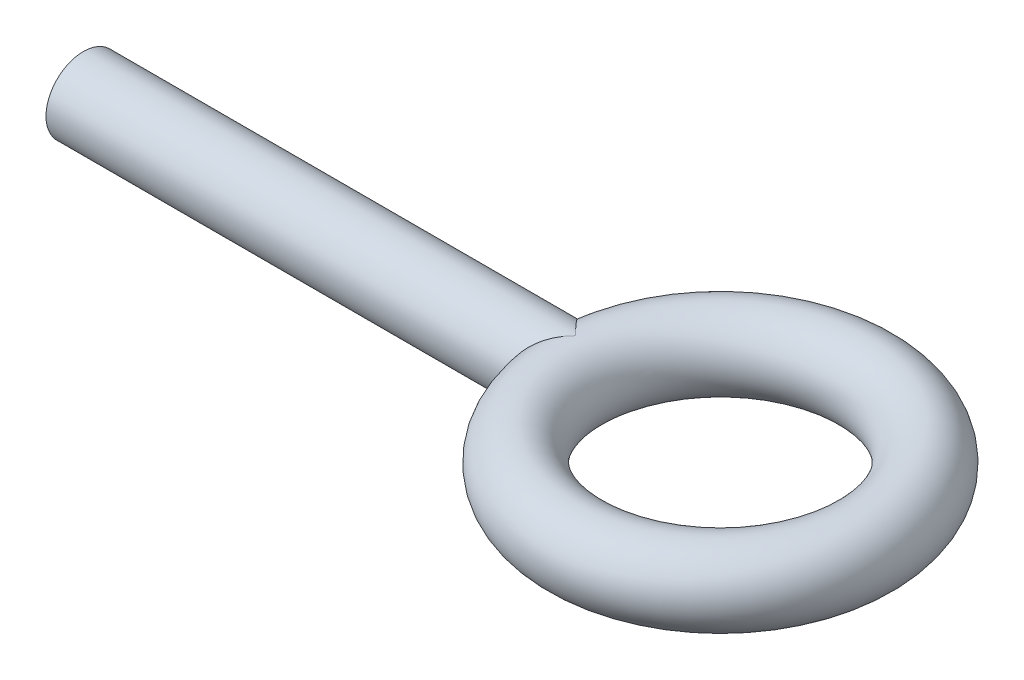
from build123d import *

# Parameters (mm, degrees)
SKETCH2_R                       = 3.6195
BOSS_EXTRUDE1_REACH             = 139.057
SKETCH3_R                       = 3.6195
BOSS_EXTRUDE1_DIRECTION_2_DEPTH = 17.272


with BuildPart() as part:
    # Sketch2 → Revolve1 (revolve)
    with BuildSketch(Plane(origin=(44.45, 0, 0), x_dir=(0, 1, 0), z_dir=(-1, 0, 0)), mode=Mode.PRIVATE) as revolve1_sk:
        with Locations((101.6, -30.4165)):
            Circle(SKETCH2_R)
    revolve(revolve1_sk.sketch.rotate(Axis((44.45, 114.3, 44.45), (0, -1, 0)), 180), axis=Axis((44.45, 114.3, 44.45), (0, -1, 0)))

    # Sketch3 → Boss-Extrude1 (add, up to next)
    with BuildSketch(Plane.ZY, mode=Mode.PRIVATE) as boss_extrude1_sk1:
        with Locations(Location((44.45, 101.6, 0), (0, 0, 270))):
            Circle(SKETCH3_R)
    boss_extrude1_tool1 = extrude(boss_extrude1_sk1.sketch, amount=-BOSS_EXTRUDE1_REACH, mode=Mode.PRIVATE) - part.part
    add(boss_extrude1_tool1.solids().sort_by_distance((0, 101.6, 44.45))[0])

    # Sketch3 → Boss-Extrude1 direction 2 (add)
    with BuildSketch(Plane.ZY):
        with Locations(Location((44.45, 101.6, 0), (0, 0, 270))):
            Circle(SKETCH3_R)
    extrude(amount=BOSS_EXTRUDE1_DIRECTION_2_DEPTH)


solid = part.part
